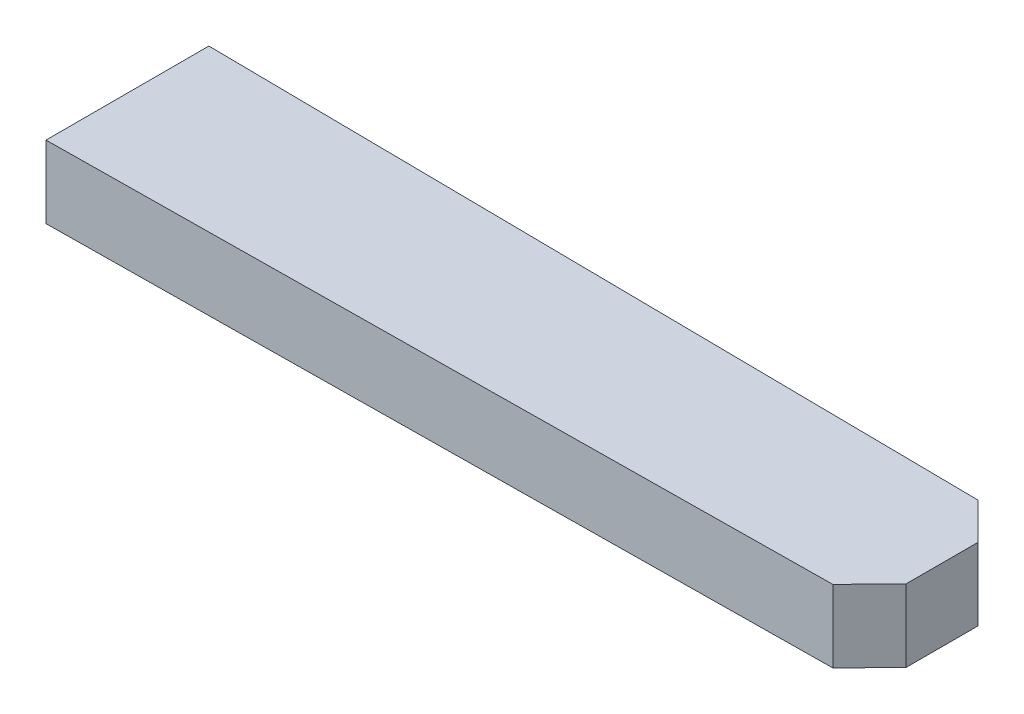
from build123d import *
from OCP.BRepFilletAPI import BRepFilletAPI_MakeChamfer

# Parameters (mm, degrees)
BOSS_EXTRUDE1_DEPTH = 4
CHAMFER2_SIZE       = 2
CHAMFER2_SIZE2      = 2.02259675


with BuildPart() as part:
    # Sketch2 → Boss-Extrude1 (new body)
    with BuildSketch(Plane(origin=(0, 0, 0), x_dir=(1, 0, 0), z_dir=(0, 1, 0))):
        Polygon((0, 9), (45, 8.5), (45, 0.5), (0, 0), align=None)
    extrude(amount=BOSS_EXTRUDE1_DEPTH)

    # Chamfer2: one chamfer whose edges measure the first distance from different faces: ONE call of the kernel's chamfer builder (chamfer() names one face for all edges)
    chamfer2_edges_1 = [part.edges().sort_by_distance(p)[0] for p in [
        (45, 2, -8.5),
    ]]
    chamfer2_side_1 = [part.faces().sort_by_distance(p)[0] for p in [
        (45, 2, -4.5),
    ]]
    chamfer2_edges_2 = [part.edges().sort_by_distance(p)[0] for p in [
        (45, 2, -0.5),
    ]]
    chamfer2_side_2 = [part.faces().sort_by_distance(p)[0] for p in [
        (22.5, 2, -0.25),
    ]]
    chamfer2 = BRepFilletAPI_MakeChamfer(part.part.solid().wrapped)
    for e in chamfer2_edges_1:
        chamfer2.Add(CHAMFER2_SIZE, CHAMFER2_SIZE2, e.wrapped, chamfer2_side_1[0].wrapped)  # the first distance lies on this face
    for e in chamfer2_edges_2:
        chamfer2.Add(CHAMFER2_SIZE, CHAMFER2_SIZE2, e.wrapped, chamfer2_side_2[0].wrapped)  # the first distance lies on this face
    add(Compound.cast(chamfer2.Shape()), mode=Mode.REPLACE)


solid = part.part
